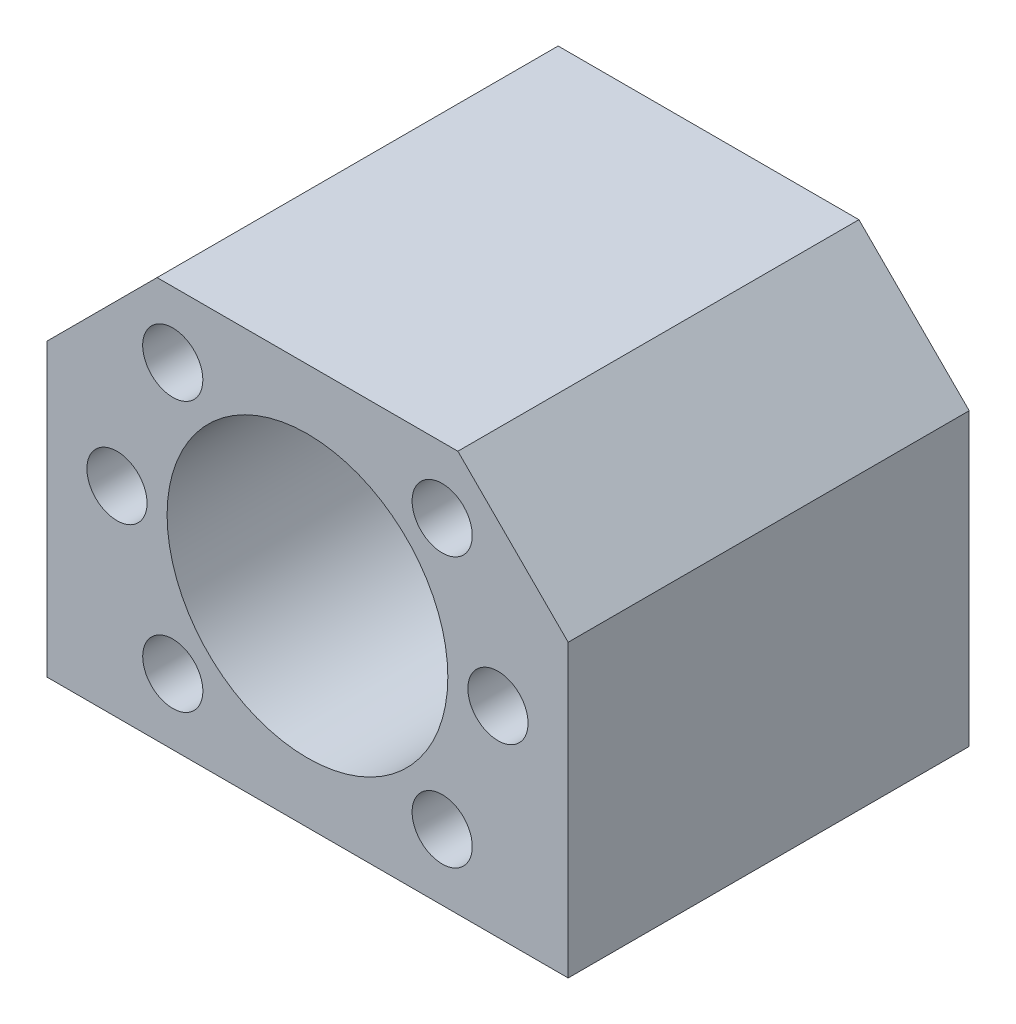
from build123d import *

# Parameters (mm, degrees)
ESQUISSE1_W             = 52
ESQUISSE1_H             = 40
BOSS_EXTRU_1_DEPTH      = 40
ESQUISSE2_R             = 14
ENL_V_MAT_EXTRU_1_DEPTH = 40
ESQUISSE3_R             = 3
ENL_V_MAT_EXTRU_2_DEPTH = 10
CHANFREIN1_SIZE         = 11
ESQUISSE4_R             = 3
ENL_V_MAT_EXTRU_3_DEPTH = 10


with BuildPart() as part:
    # Esquisse1 → Boss.-Extru.1 (new body)
    with BuildSketch(Plane.XY):
        with Locations((26, 20)):
            Rectangle(ESQUISSE1_W, ESQUISSE1_H)
    extrude(amount=BOSS_EXTRU_1_DEPTH)

    # Esquisse2 → Enlèv. mat.-Extru.1 (cut)
    with BuildSketch(Plane.XY.offset(40)):
        with Locations((26, 20)):
            Circle(ESQUISSE2_R)
    extrude(amount=-ENL_V_MAT_EXTRU_1_DEPTH, mode=Mode.SUBTRACT)

    # Esquisse3 → Enlèv. mat.-Extru.2 (cut)
    with BuildSketch(Plane.XY.offset(40)):
        with Locations((7, 20)):
            Circle(ESQUISSE3_R)
        with Locations((12.564971157, 33.435028843)):
            Circle(ESQUISSE3_R)
        with Locations(Location((12.564971157, 6.564971157, 0), (0, 0, 180))):
            Circle(ESQUISSE3_R)
        with Locations((39.435028843, 6.564971157)):
            Circle(ESQUISSE3_R)
        with Locations(Location((39.435028843, 33.435028843, 0), (0, 0, 180))):
            Circle(ESQUISSE3_R)
        with Locations(Location((45, 20, 0), (0, 0, 180))):
            Circle(ESQUISSE3_R)
    extrude(amount=-ENL_V_MAT_EXTRU_2_DEPTH, mode=Mode.SUBTRACT)

    # Chanfrein1
    chanfrein1_edges = [part.edges().sort_by_distance(p)[0] for p in [
        (0, 40, 20),
        (52, 40, 20),
    ]]
    chamfer(chanfrein1_edges, length=CHANFREIN1_SIZE)

    # Esquisse4 → Enlèv. mat.-Extru.3 (cut)
    with BuildSketch(Plane.XZ):
        with Locations(Location((6, 32, 0), (0, 0, 270))):
            Circle(ESQUISSE4_R)
        with Locations(Location((6, 8, 0), (0, 0, 90))):
            Circle(ESQUISSE4_R)
        with Locations(Location((46, 8, 0), (0, 0, 270))):
            Circle(ESQUISSE4_R)
        with Locations(Location((46, 32, 0), (0, 0, 90))):
            Circle(ESQUISSE4_R)
    extrude(amount=-ENL_V_MAT_EXTRU_3_DEPTH, mode=Mode.SUBTRACT)


solid = part.part
